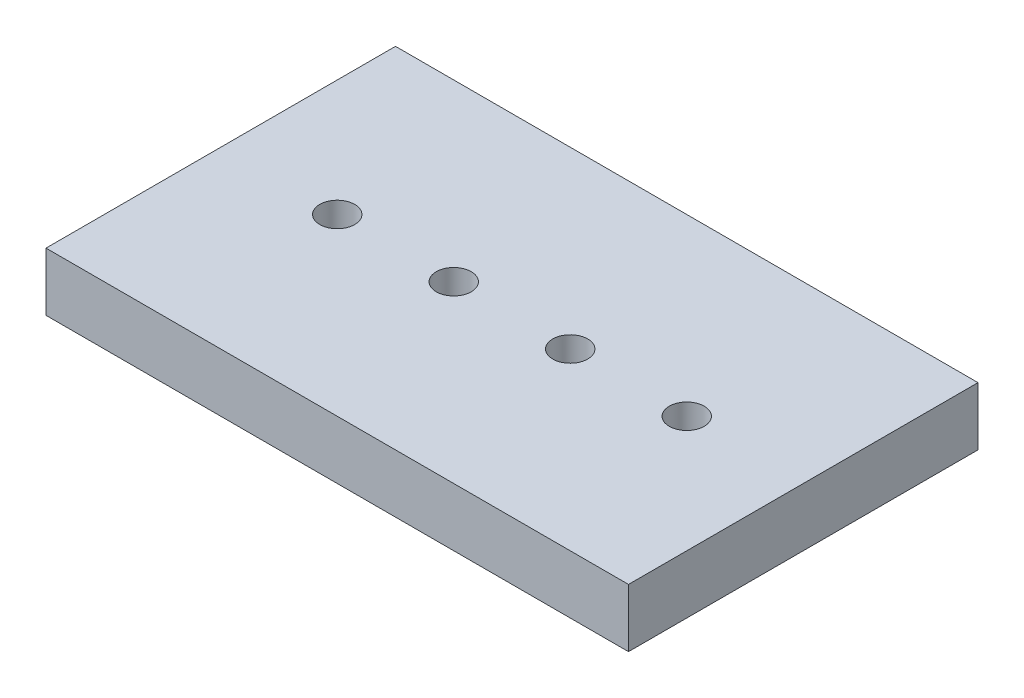
from build123d import *

# Parameters (mm, degrees)
SKETCH_1_W             = 100
SKETCH_1_H             = 60
EXTRUDE_1_DEPTH        = 10
SKETCH_2_R             = 3
CUT_EXTRUDE_1_DEPTH    = 20
PATTERN_LINEAR_1_COUNT = 4
PATTERN_LINEAR_1_PITCH = 20


with BuildPart() as part:
    # 草图1 → 凸台-拉伸1 (new body)
    with BuildSketch(Plane(origin=(0, 0, 0), x_dir=(1, 0, 0), z_dir=(0, 1, 0))):
        Rectangle(SKETCH_1_W, SKETCH_1_H)
    extrude(amount=EXTRUDE_1_DEPTH)

    # 草图2 → 切除-拉伸1 (cut)
    with BuildSketch(Plane(origin=(0, 0, 0), x_dir=(1, 0, 0), z_dir=(0, 1, 0))):
        with Locations(Location((-30, 0, 0), (0, 0, 90))):
            Circle(SKETCH_2_R)
    cut_extrude_1 = extrude(amount=CUT_EXTRUDE_1_DEPTH, mode=Mode.SUBTRACT)

    # 阵列(线性)1: 切除-拉伸1 ×4
    with Locations(*[(i * PATTERN_LINEAR_1_PITCH, 0, 0) for i in range(1, PATTERN_LINEAR_1_COUNT)]):
        add(cut_extrude_1, mode=Mode.SUBTRACT)


solid = part.part
